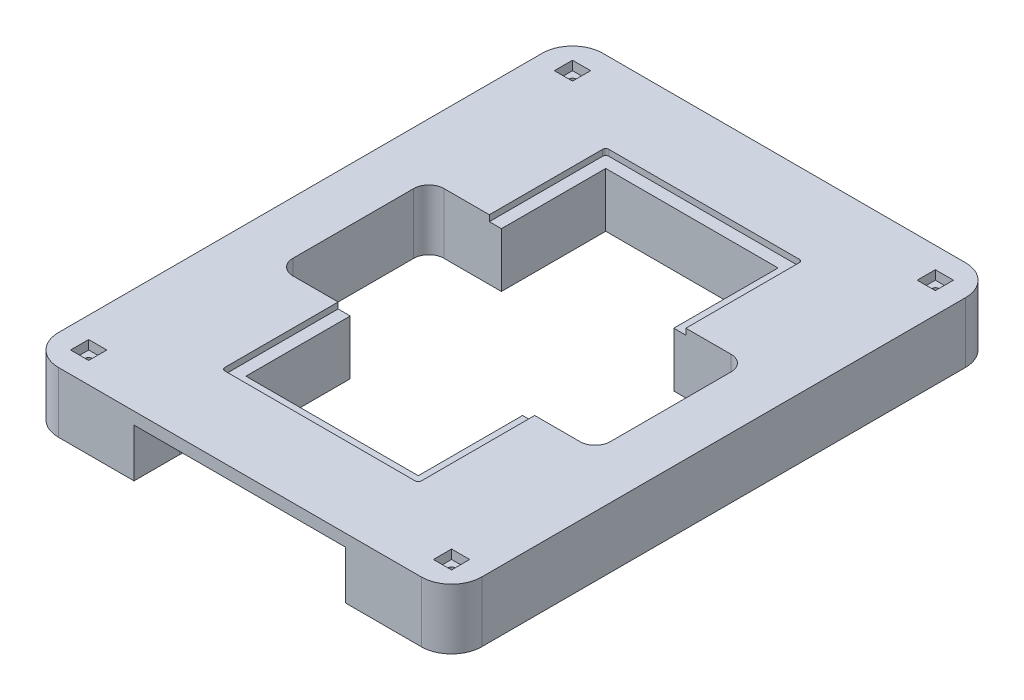
from build123d import *

# Parameters (mm, degrees)
SKETCH_1_W                                 = 200
SKETCH_1_H                                 = 200
EXTRUDE_1_DEPTH                            = 20
SKETCH_2_W                                 = 200
SKETCH_2_H                                 = 200
SKETCH_2_W_2                               = 140
SKETCH_2_H_2                               = 180
CUT_EXTRUDE_2_DEPTH                        = 143.828568571
FILLET_1_R                                 = 10
FILLET_2_R                                 = 10
FILLET_3_R                                 = 10
FILLET_4_R                                 = 10
CUT_EXTRUDE_4_DEPTH                        = 5
MIRROR_3_AT_THE_SECOND_PLANE_COPY_1_DEPTH  = 5
SKETCH_5_R                                 = 5
CUT_EXTRUDE_5_DEPTH                        = 6.2
CUT_EXTRUDE_7_DEPTH                        = 16
SKETCH_8_R                                 = 4.1
CUT_EXTRUDE_8_DEPTH                        = 4
DRAFT_2_ANGLE                              = 10
DRAFT_2_OF_MIRROR_10_2_ANGLE               = 10
DRAFT_2_OF_MIRROR_11_2_ANGLE               = 10
SKETCH_14_W                                = 6
SKETCH_14_H                                = 6
CUT_EXTRUDE_9_DEPTH                        = 3
MIRROR_12_AT_THE_SECOND_PLANE_COPY_1_SKE_W = 6
MIRROR_12_AT_THE_SECOND_PLANE_COPY_1_SKE_H = 6
MIRROR_12_AT_THE_SECOND_PLANE_COPY_1_DEPTH = 3
CUT_EXTRUDE_14_DEPTH                       = 2
SKETCH_22_W                                = 57
SKETCH_22_H                                = 119
CUT_EXTRUDE_15_DEPTH                       = 116.429632244
CUT_EXTRUDE_16_DEPTH                       = 116.758369028
SKETCH_24_R                                = 1.2
CUT_EXTRUDE_17_DEPTH                       = 116.758369028
MIRROR_13_AT_THE_SECOND_PLANE_COPY_1_SKE_R = 1.2
MIRROR_13_AT_THE_SECOND_PLANE_COPY_1_DEPTH = 116.758369028


with BuildPart() as part:
    # 草图1 → 凸台-拉伸1 (new body)
    with BuildSketch(Plane(origin=(0, 0, 0), x_dir=(1, 0, 0), z_dir=(0, 1, 0))):
        Rectangle(SKETCH_1_W, SKETCH_1_H)
    extrude(amount=EXTRUDE_1_DEPTH)

    # 草图2 → 切除-拉伸2 (cut, through all)
    with BuildSketch(Plane(origin=(0, 20, 0), x_dir=(1, 0, 0), z_dir=(0, 1, 0))):
        Rectangle(SKETCH_2_W, SKETCH_2_H)
        Rectangle(SKETCH_2_W_2, SKETCH_2_H_2, mode=Mode.SUBTRACT)
    extrude(amount=-CUT_EXTRUDE_2_DEPTH, mode=Mode.SUBTRACT)

    # 圆角1
    fillet_1_edges = [part.edges().sort_by_distance(p)[0] for p in [
        (-70, 10, -90),
    ]]
    fillet(fillet_1_edges, radius=FILLET_1_R)

    # 圆角2
    fillet_2_edges = [part.edges().sort_by_distance(p)[0] for p in [
        (70, 10, -90),
    ]]
    fillet(fillet_2_edges, radius=FILLET_2_R)

    # 圆角3
    fillet_3_edges = [part.edges().sort_by_distance(p)[0] for p in [
        (70, 10, 90),
    ]]
    fillet(fillet_3_edges, radius=FILLET_3_R)

    # 圆角4
    fillet_4_edges = [part.edges().sort_by_distance(p)[0] for p in [
        (-70, 10, 90),
    ]]
    fillet(fillet_4_edges, radius=FILLET_4_R)

    # 草图4 → 切除-拉伸4 (cut)
    with BuildSketch(Plane.XZ):
        with BuildLine():
            Line((-59.5, 84.974937186), (-59.5, 86))
            Line((-59.5, 86), (-60.5, 86))
            Line((-60.5, 86), (-60.5, 84.974937186))
            ThreePointArc((-60.5, 84.974937186), (-63.535533906, 83.535533906), (-64.974937186, 80.5))
            Line((-64.974937186, 80.5), (-66, 80.5))
            Line((-66, 80.5), (-66, 79.5))
            Line((-66, 79.5), (-64.974937186, 79.5))
            ThreePointArc((-64.974937186, 79.5), (-63.535533906, 76.464466094), (-60.5, 75.025062814))
            Line((-60.5, 75.025062814), (-60.5, 74))
            Line((-60.5, 74), (-59.5, 74))
            Line((-59.5, 74), (-59.5, 75.025062814))
            ThreePointArc((-59.5, 75.025062814), (-56.464466094, 76.464466094), (-55.025062814, 79.5))
            Line((-55.025062814, 79.5), (-54, 79.5))
            Line((-54, 79.5), (-54, 80.5))
            Line((-54, 80.5), (-55.025062814, 80.5))
            ThreePointArc((-55.025062814, 80.5), (-56.464466094, 83.535533906), (-59.5, 84.974937186))
        make_face()
    cut_extrude_4 = extrude(amount=-CUT_EXTRUDE_4_DEPTH, mode=Mode.SUBTRACT)

    # 镜向3: 切除-拉伸4 across plane
    add(cut_extrude_4.mirror(Plane(origin=(0, 0, 0), x_dir=(0, 0, 1), z_dir=(1, 0, 0))), mode=Mode.SUBTRACT)

    # 镜向3 at the second plane: 切除-拉伸4 across plane
    add(cut_extrude_4.mirror(Plane.XY), mode=Mode.SUBTRACT)

    # 镜向3 at the second plane copy 1 sket → 镜向3 at the second plane copy 1 (cut)
    with BuildSketch(Plane(origin=(0, 0, 0), x_dir=(-1, 0, 0), z_dir=(0, -1, 0))):
        with BuildLine():
            Line((-59.5, 84.974937186), (-59.5, 86))
            Line((-59.5, 86), (-60.5, 86))
            Line((-60.5, 86), (-60.5, 84.974937186))
            ThreePointArc((-60.5, 84.974937186), (-63.535533906, 83.535533906), (-64.974937186, 80.5))
            Line((-64.974937186, 80.5), (-66, 80.5))
            Line((-66, 80.5), (-66, 79.5))
            Line((-66, 79.5), (-64.974937186, 79.5))
            ThreePointArc((-64.974937186, 79.5), (-63.535533906, 76.464466094), (-60.5, 75.025062814))
            Line((-60.5, 75.025062814), (-60.5, 74))
            Line((-60.5, 74), (-59.5, 74))
            Line((-59.5, 74), (-59.5, 75.025062814))
            ThreePointArc((-59.5, 75.025062814), (-56.464466094, 76.464466094), (-55.025062814, 79.5))
            Line((-55.025062814, 79.5), (-54, 79.5))
            Line((-54, 79.5), (-54, 80.5))
            Line((-54, 80.5), (-55.025062814, 80.5))
            ThreePointArc((-55.025062814, 80.5), (-56.464466094, 83.535533906), (-59.5, 84.974937186))
        make_face()
    extrude(amount=-MIRROR_3_AT_THE_SECOND_PLANE_COPY_1_DEPTH, mode=Mode.SUBTRACT)

    # 草图5 → 切除-拉伸5 (cut)
    with BuildSketch(Plane.XZ):
        with Locations(Location((-60, 80, 0), (0, 0, 270))):
            Circle(SKETCH_5_R)
    extrude(amount=-CUT_EXTRUDE_5_DEPTH, mode=Mode.SUBTRACT)

    # 草图7 → 切除-拉伸7 (cut)
    with BuildSketch(Plane.XZ):
        with BuildLine():
            Line((35, 110), (-35, 110))
            Line((-35, 110), (-35, 75))
            ThreePointArc((-35, 75), (-33.535533906, 71.464466094), (-30, 70))
            Line((-30, 70), (30, 70))
            ThreePointArc((30, 70), (33.535533906, 71.464466094), (35, 75))
            Line((35, 75), (35, 110))
        make_face()
    cut_extrude_7 = extrude(amount=-CUT_EXTRUDE_7_DEPTH, mode=Mode.SUBTRACT)

    # 镜向6: 切除-拉伸7 across plane
    add(cut_extrude_7.mirror(Plane.XY), mode=Mode.SUBTRACT)

    # 草图8 → 切除-拉伸8 (cut)
    with BuildSketch(Plane.XZ):
        with Locations(Location((-40.5, 40.5, 0), (0, 0, 270))):
            Circle(SKETCH_8_R)
    cut_extrude_8 = extrude(amount=-CUT_EXTRUDE_8_DEPTH, mode=Mode.SUBTRACT)

    # 拔模2
    draft_2_faces = [part.faces().sort_by_distance(p)[0] for p in [
        (-40.5, 2, 44.6),
    ]]
    draft(draft_2_faces, Plane(origin=(-40.5, 4, 40.5), x_dir=(0, 0, -1), z_dir=(0, -1, 0)), DRAFT_2_ANGLE)

    # 镜向10: 切除-拉伸8 across plane
    add(cut_extrude_8.mirror(Plane(origin=(0, 0, 0), x_dir=(0, 0, 1), z_dir=(1, 0, 0))), mode=Mode.SUBTRACT)

    # 拔模2 of Mirror 10 2
    draft_2_of_mirror_10_2_faces = [part.faces().sort_by_distance(p)[0] for p in [
        (40.5, 2, 44.6),
    ]]
    draft(draft_2_of_mirror_10_2_faces, Plane(origin=(40.5, 4, 40.5), x_dir=(0, 0, -1), z_dir=(0, -1, 0)), DRAFT_2_OF_MIRROR_10_2_ANGLE)

    # 镜向11: 切除-拉伸8 across plane
    add(cut_extrude_8.mirror(Plane.XY), mode=Mode.SUBTRACT)

    # 拔模2 of Mirror 11 2
    draft_2_of_mirror_11_2_faces = [part.faces().sort_by_distance(p)[0] for p in [
        (-40.5, 2, -44.6),
    ]]
    draft(draft_2_of_mirror_11_2_faces, Plane(origin=(-40.5, 4, -40.5), x_dir=(0, 0, 1), z_dir=(0, -1, 0)), DRAFT_2_OF_MIRROR_11_2_ANGLE)

    # 草图14 → 切除-拉伸9 (cut)
    with BuildSketch(Plane(origin=(0, 20, 0), x_dir=(1, 0, 0), z_dir=(0, 1, 0))):
        with Locations((-60, 80)):
            Rectangle(SKETCH_14_W, SKETCH_14_H)
    cut_extrude_9 = extrude(amount=-CUT_EXTRUDE_9_DEPTH, mode=Mode.SUBTRACT)

    # 镜向12: 切除-拉伸9 across plane
    add(cut_extrude_9.mirror(Plane(origin=(0, 0, 0), x_dir=(0, 0, 1), z_dir=(1, 0, 0))), mode=Mode.SUBTRACT)

    # 镜向12 at the second plane: 切除-拉伸9 across plane
    add(cut_extrude_9.mirror(Plane.XY), mode=Mode.SUBTRACT)

    # 镜向12 at the second plane copy 1 ske → 镜向12 at the second plane copy 1 (cut)
    with BuildSketch(Plane(origin=(0, 20, 0), x_dir=(-1, 0, 0), z_dir=(0, 1, 0))):
        with Locations((-60, 80)):
            Rectangle(MIRROR_12_AT_THE_SECOND_PLANE_COPY_1_SKE_W, MIRROR_12_AT_THE_SECOND_PLANE_COPY_1_SKE_H)
    extrude(amount=-MIRROR_12_AT_THE_SECOND_PLANE_COPY_1_DEPTH, mode=Mode.SUBTRACT)

    # 草图21 → 切除-拉伸14 (cut)
    with BuildSketch(Plane(origin=(0, 20, 0), x_dir=(1, 0, 0), z_dir=(0, 1, 0))):
        with BuildLine():
            Line((31.5, -63.5), (-31.5, -63.5))
            ThreePointArc((-31.5, -63.5), (-32.207106781, -63.207106781), (-32.5, -62.5))
            Line((-32.5, -62.5), (-32.5, 62.5))
            ThreePointArc((-32.5, 62.5), (-32.207106781, 63.207106781), (-31.5, 63.5))
            Line((-31.5, 63.5), (31.5, 63.5))
            ThreePointArc((31.5, 63.5), (32.207106781, 63.207106781), (32.5, 62.5))
            Line((32.5, 62.5), (32.5, -62.5))
            ThreePointArc((32.5, -62.5), (32.207106781, -63.207106781), (31.5, -63.5))
        make_face()
    extrude(amount=-CUT_EXTRUDE_14_DEPTH, mode=Mode.SUBTRACT)

    # 草图22 → 切除-拉伸15 (cut, through all)
    with BuildSketch(Plane(origin=(0, 18, 0), x_dir=(1, 0, 0), z_dir=(0, 1, 0))):
        Rectangle(SKETCH_22_W, SKETCH_22_H)
    extrude(amount=-CUT_EXTRUDE_15_DEPTH, mode=Mode.SUBTRACT)

    # 草图23 → 切除-拉伸16 (cut, through all)
    with BuildSketch(Plane(origin=(0, 20, 0), x_dir=(1, 0, 0), z_dir=(0, 1, 0))):
        with BuildLine():
            Line((47.5, -25), (-47.5, -25))
            ThreePointArc((-47.5, -25), (-51.035533906, -23.535533906), (-52.5, -20))
            Line((-52.5, -20), (-52.5, 20))
            ThreePointArc((-52.5, 20), (-51.035533906, 23.535533906), (-47.5, 25))
            Line((-47.5, 25), (47.5, 25))
            ThreePointArc((47.5, 25), (51.035533906, 23.535533906), (52.5, 20))
            Line((52.5, 20), (52.5, -20))
            ThreePointArc((52.5, -20), (51.035533906, -23.535533906), (47.5, -25))
        make_face()
    extrude(amount=-CUT_EXTRUDE_16_DEPTH, mode=Mode.SUBTRACT)

    # 草图24 → 切除-拉伸17 (cut, through all)
    with BuildSketch(Plane.XZ):
        with Locations(Location((-60, 80, 0), (0, 0, 270))):
            Circle(SKETCH_24_R)
    cut_extrude_17 = extrude(amount=-CUT_EXTRUDE_17_DEPTH, mode=Mode.SUBTRACT)

    # 镜向13: 切除-拉伸17 across plane
    add(cut_extrude_17.mirror(Plane.XY), mode=Mode.SUBTRACT)

    # 镜向13 at the second plane: 切除-拉伸17 across plane
    add(cut_extrude_17.mirror(Plane(origin=(0, 0, 0), x_dir=(0, 0, 1), z_dir=(1, 0, 0))), mode=Mode.SUBTRACT)

    # 镜向13 at the second plane copy 1 ske → 镜向13 at the second plane copy 1 (cut, through all)
    with BuildSketch(Plane(origin=(0, 0, 0), x_dir=(-1, 0, 0), z_dir=(0, -1, 0))):
        with Locations(Location((-60, 80, 0), (0, 0, 270))):
            Circle(MIRROR_13_AT_THE_SECOND_PLANE_COPY_1_SKE_R)
    extrude(amount=-MIRROR_13_AT_THE_SECOND_PLANE_COPY_1_DEPTH, mode=Mode.SUBTRACT)


solid = part.part
